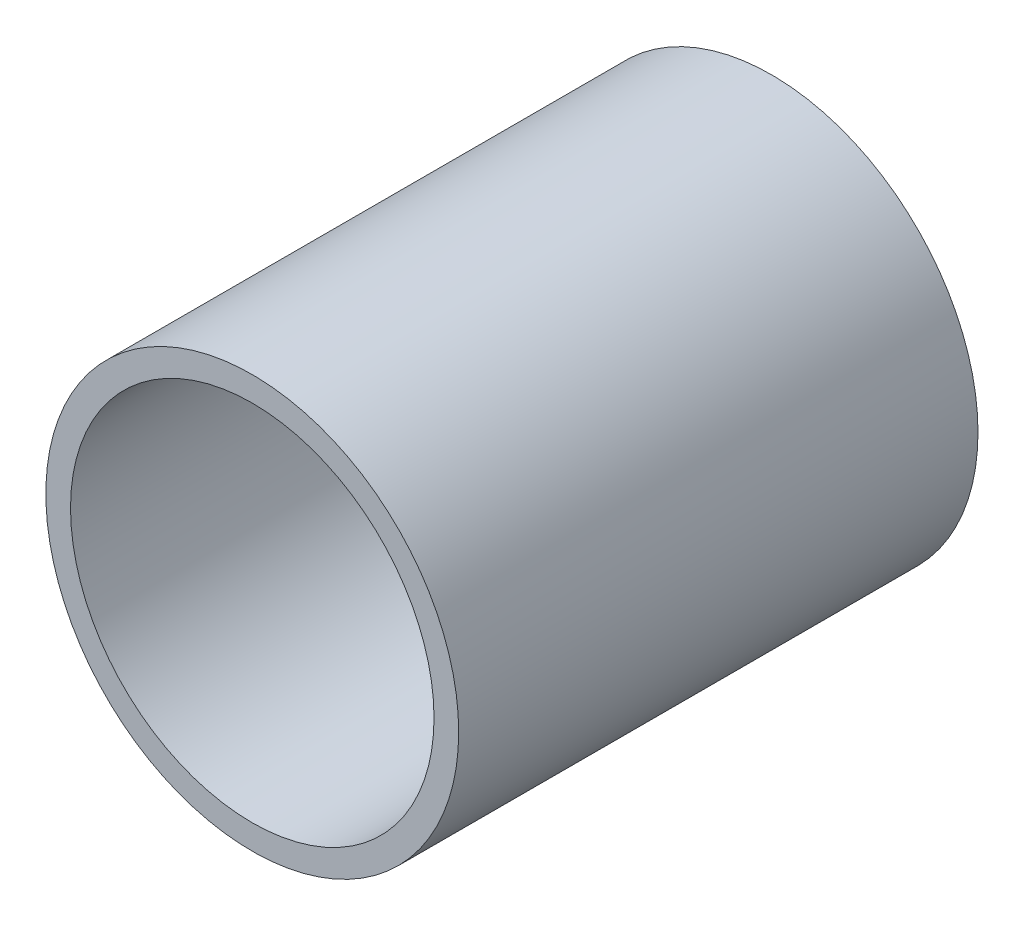
from build123d import *

# Parameters (mm, degrees)
SKETCH1_R           = 7.95
SKETCH1_R_2         = 7
BOSS_EXTRUDE1_DEPTH = 20


with BuildPart() as part:
    # Sketch1 → Boss-Extrude1 (new body)
    with BuildSketch(Plane.XY):
        Circle(SKETCH1_R)
        Circle(SKETCH1_R_2, mode=Mode.SUBTRACT)
    extrude(amount=BOSS_EXTRUDE1_DEPTH)


solid = part.part
